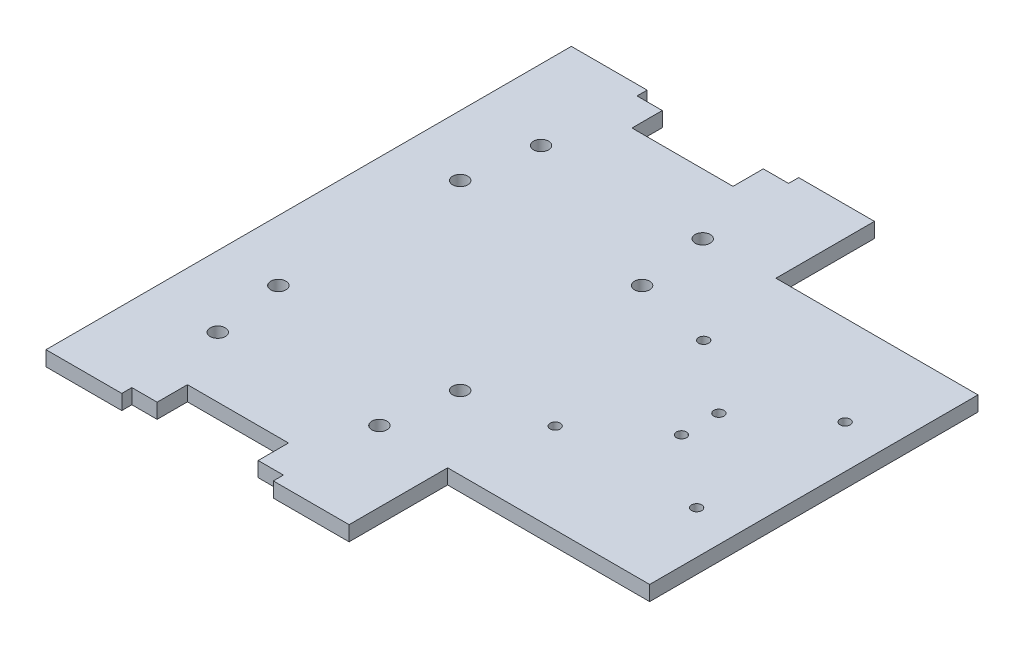
from build123d import *

# Parameters (mm, degrees)
SKETCH_1_R      = 1
SKETCH_1_R_2    = 1.5
EXTRUDE_1_DEPTH = 2.95


with BuildPart() as part:
    # 草图1 → 凸台-拉伸1 (new body)
    with BuildSketch(Plane(origin=(0, 0, 0), x_dir=(1, 0, 0), z_dir=(0, 1, 0))):
        Polygon((25, 50), (20, 50), (20, 44), (0, 44), (0, 50), (-5, 50), (-5, 52), (-20, 52), (-20, 50), (-20, -50), (-20, -52), (-5, -52), (-5, -50), (0, -50), (0, -44), (20, -44), (20, -50), (25, -50), (25, -52), (40, -52), (40, -50), (40, -32.5), (70, -32.5), (80, -32.5), (80, -30), (80, 30), (80, 32.5), (70, 32.5), (40, 32.5), (40, 50), (40, 52), (25, 52), align=None)
        with Locations(Location((71.5, 14.7, 0), (0, 0, 90))):
            Circle(SKETCH_1_R, mode=Mode.SUBTRACT)
        with Locations(Location((43.5, 14.7, 0), (0, 0, 90))):
            Circle(SKETCH_1_R, mode=Mode.SUBTRACT)
        with Locations(Location((57.5, 3.7, 0), (0, 0, 90))):
            Circle(SKETCH_1_R, mode=Mode.SUBTRACT)
        with Locations(Location((26, 32, 0), (0, 0, 270))):
            Circle(SKETCH_1_R_2, mode=Mode.SUBTRACT)
        with Locations(Location((-6, 32, 0), (0, 0, 270))):
            Circle(SKETCH_1_R_2, mode=Mode.SUBTRACT)
        with Locations(Location((28, 18, 0), (0, 0, 270))):
            Circle(SKETCH_1_R_2, mode=Mode.SUBTRACT)
        with Locations(Location((-8, 18, 0), (0, 0, 270))):
            Circle(SKETCH_1_R_2, mode=Mode.SUBTRACT)
        with Locations(Location((-8, -18, 0), (0, 0, 90))):
            Circle(SKETCH_1_R_2, mode=Mode.SUBTRACT)
        with Locations(Location((28, -18, 0), (0, 0, 90))):
            Circle(SKETCH_1_R_2, mode=Mode.SUBTRACT)
        with Locations(Location((-6, -32, 0), (0, 0, 90))):
            Circle(SKETCH_1_R_2, mode=Mode.SUBTRACT)
        with Locations(Location((26, -32, 0), (0, 0, 90))):
            Circle(SKETCH_1_R_2, mode=Mode.SUBTRACT)
        with Locations(Location((57.5, -3.7, 0), (0, 0, 270))):
            Circle(SKETCH_1_R, mode=Mode.SUBTRACT)
        with Locations(Location((43.5, -14.7, 0), (0, 0, 270))):
            Circle(SKETCH_1_R, mode=Mode.SUBTRACT)
        with Locations(Location((71.5, -14.7, 0), (0, 0, 270))):
            Circle(SKETCH_1_R, mode=Mode.SUBTRACT)
    extrude(amount=EXTRUDE_1_DEPTH)


solid = part.part
